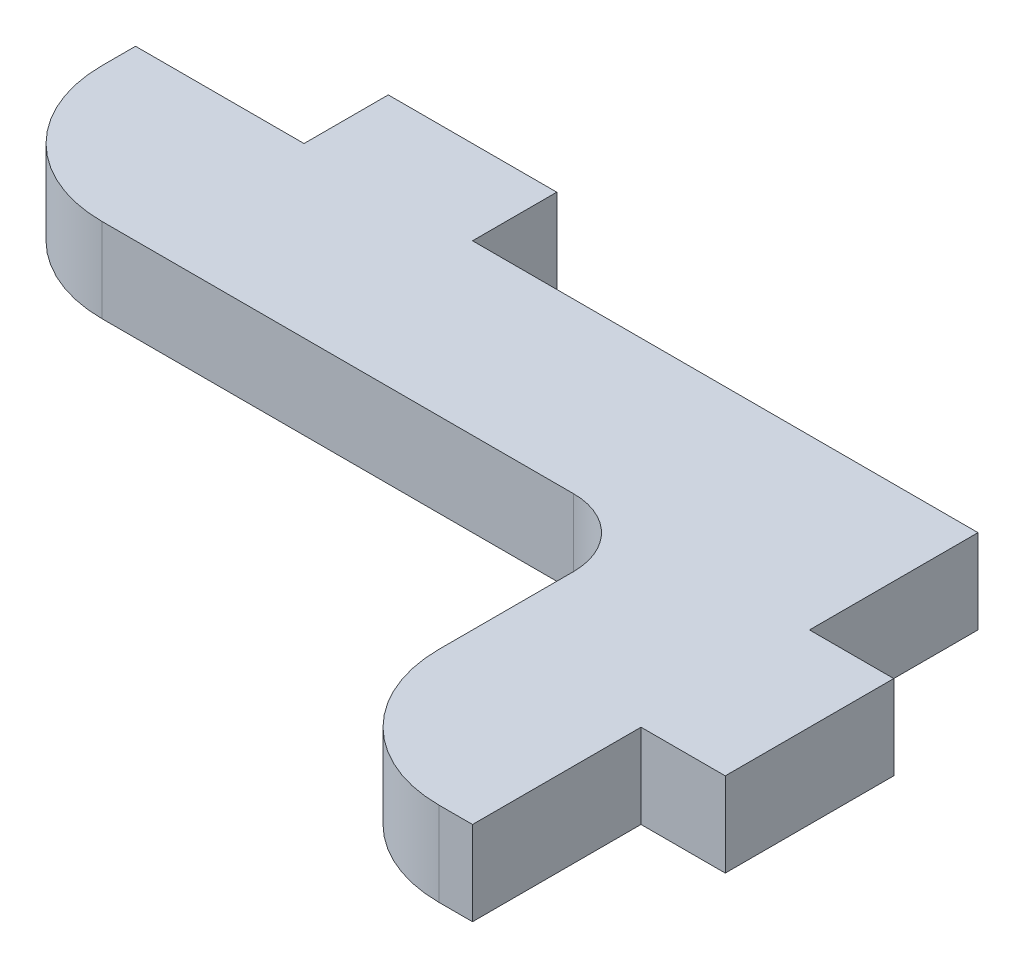
from build123d import *

# Parameters (mm, degrees)
EXTRUDE_1_DEPTH = 5


with BuildPart() as part:
    # 草图1 → 凸台-拉伸1 (new body)
    with BuildSketch(Plane(origin=(0, 0, 0), x_dir=(1, 0, 0), z_dir=(0, 1, 0))):
        with BuildLine():
            Line((8, 0), (36, 0))
            ThreePointArc((36, 0), (38.828427125, -1.171572875), (40, -4))
            Line((40, -4), (40, -12))
            ThreePointArc((40, -12), (42.343145751, -17.656854249), (48, -20))
            Line((48, -20), (50, -20))
            Line((50, -20), (50, -10))
            Line((50, -10), (55, -10))
            Line((55, -10), (55, 0))
            Line((55, 0), (50, 0))
            Line((50, 0), (50, 10))
            Line((50, 10), (20, 10))
            Line((20, 10), (20, 15))
            Line((20, 15), (10, 15))
            Line((10, 15), (10, 10))
            Line((10, 10), (0, 10))
            Line((0, 10), (0, 8))
            ThreePointArc((0, 8), (2.343145751, 2.343145751), (8, 0))
        make_face()
    extrude(amount=EXTRUDE_1_DEPTH)


solid = part.part
